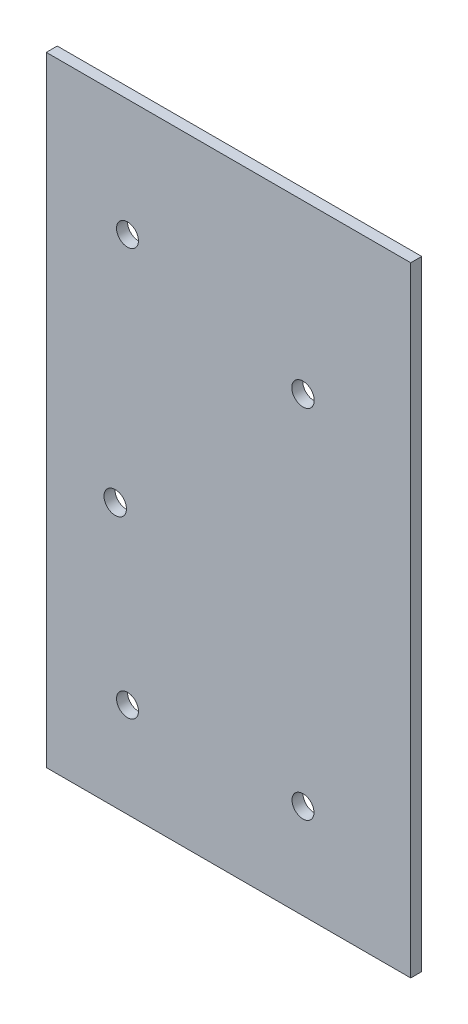
from build123d import *

# Parameters (mm, degrees)
SKETCH1_W           = 105.497827183
SKETCH1_H           = 179.29887024
SKETCH1_R           = 3.175
SKETCH1_R_2         = 3.2512
BOSS_EXTRUDE1_DEPTH = 3.175


with BuildPart() as part:
    # Sketch1 → Boss-Extrude1 (new body)
    with BuildSketch(Plane.XY):
        with Locations((54.6380005, 121.166691813)):
            Rectangle(SKETCH1_W, SKETCH1_H)
        with Locations((25.4, 58.964285714)):
            Circle(SKETCH1_R, mode=Mode.SUBTRACT)
        with Locations((76.2, 58.964285714)):
            Circle(SKETCH1_R, mode=Mode.SUBTRACT)
        with Locations((25.4, 176.892857143)):
            Circle(SKETCH1_R, mode=Mode.SUBTRACT)
        with Locations((76.2, 162.306)):
            Circle(SKETCH1_R_2, mode=Mode.SUBTRACT)
        with Locations((21.844, 107.95)):
            Circle(SKETCH1_R_2, mode=Mode.SUBTRACT)
    extrude(amount=BOSS_EXTRUDE1_DEPTH)


solid = part.part
